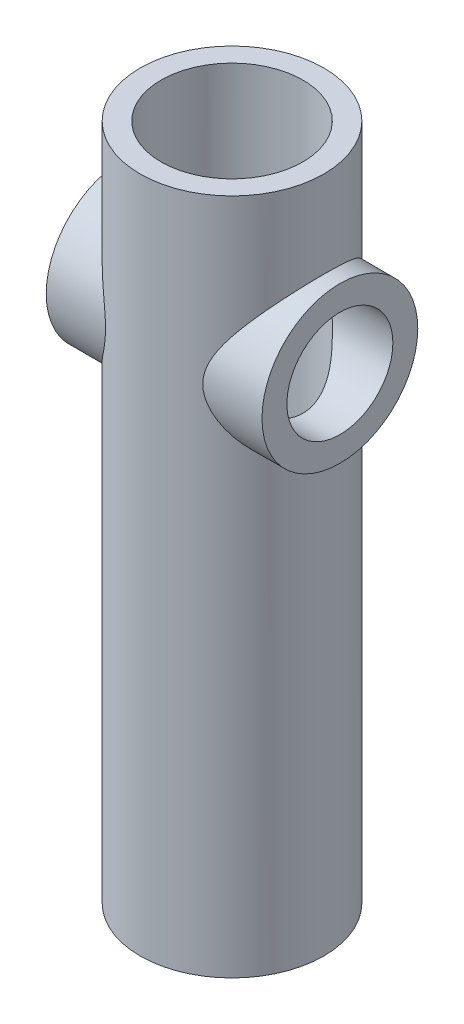
from build123d import *

# Parameters (mm, degrees)
BOSS_EXTRUDE1_DEPTH      = 45.372782
BOSS_EXTRUDE1_DEPTH_BACK = 45.388276
SKETCH1_R                = 32.766
BOSS_EXTRUDE2_DEPTH      = 69.287898
BOSS_EXTRUDE2_DEPTH_BACK = 215.617298
SKETCH2_R                = 38.6334
CUT_EXTRUDE1_DEPTH       = 224.703943753
CUT_EXTRUDE1_DEPTH_BACK  = 224.703943753
SKETCH3_R                = 22.292818
CUT_EXTRUDE2_DEPTH       = 224.703943753
CUT_EXTRUDE2_DEPTH_BACK  = 198.41972
SKETCH4_R                = 29.840301


with BuildPart() as part:
    # Sketch1 → Boss-Extrude1 (new, two sides: drawn at the far end of the back side and taken through both)
    with BuildSketch(Plane(origin=(0, 0, 0), x_dir=(0, 0, -1), z_dir=(1, 0, 0)).offset(-BOSS_EXTRUDE1_DEPTH_BACK)):
        Circle(SKETCH1_R)
    extrude(amount=BOSS_EXTRUDE1_DEPTH + BOSS_EXTRUDE1_DEPTH_BACK)

    # Sketch2 → Boss-Extrude2 (add, two sides: drawn at the far end of the back side and taken through both)
    with BuildSketch(Plane(origin=(0, 0, 0), x_dir=(1, 0, 0), z_dir=(0, 1, 0)).offset(-BOSS_EXTRUDE2_DEPTH_BACK)):
        with Locations(Location((0, 0, 0), (0, 0, 270))):
            Circle(SKETCH2_R)
    extrude(amount=BOSS_EXTRUDE2_DEPTH + BOSS_EXTRUDE2_DEPTH_BACK)

    # Sketch3 → Cut-Extrude1 (cut, two sides: drawn at the far end of the back side and taken through both)
    with BuildSketch(Plane(origin=(0, 0, 0), x_dir=(0, 0, -1), z_dir=(1, 0, 0)).offset(-CUT_EXTRUDE1_DEPTH_BACK)):
        Circle(SKETCH3_R)
    extrude(amount=CUT_EXTRUDE1_DEPTH + CUT_EXTRUDE1_DEPTH_BACK, mode=Mode.SUBTRACT)

    # Sketch4 → Cut-Extrude2 (cut, two sides: drawn at the far end of the back side and taken through both)
    with BuildSketch(Plane(origin=(0, 0, 0), x_dir=(1, 0, 0), z_dir=(0, 1, 0)).offset(-CUT_EXTRUDE2_DEPTH_BACK)):
        with Locations(Location((0, 0, 0), (0, 0, 270))):
            Circle(SKETCH4_R)
    extrude(amount=CUT_EXTRUDE2_DEPTH + CUT_EXTRUDE2_DEPTH_BACK, mode=Mode.SUBTRACT)


solid = part.part
